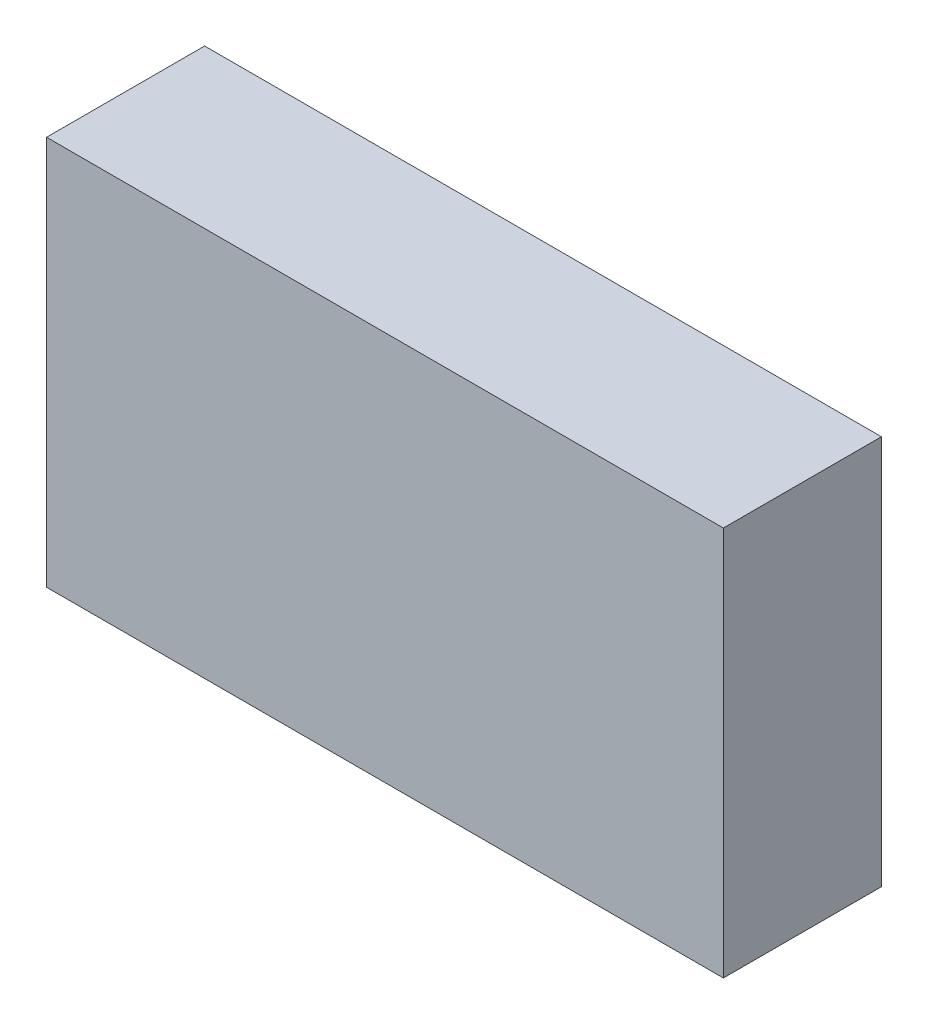
from build123d import *

# Parameters (mm, degrees)
ANCHORSKETCH_W   = 31.73
ANCHORSKETCH_H   = 18.27
ANCHORBOSS_DEPTH = 7.41


with BuildPart() as part:
    # AnchorSketch → AnchorBoss (new body)
    with BuildSketch(Plane.XY):
        with Locations((15.865, 9.135)):
            Rectangle(ANCHORSKETCH_W, ANCHORSKETCH_H)
    extrude(amount=ANCHORBOSS_DEPTH)


solid = part.part
